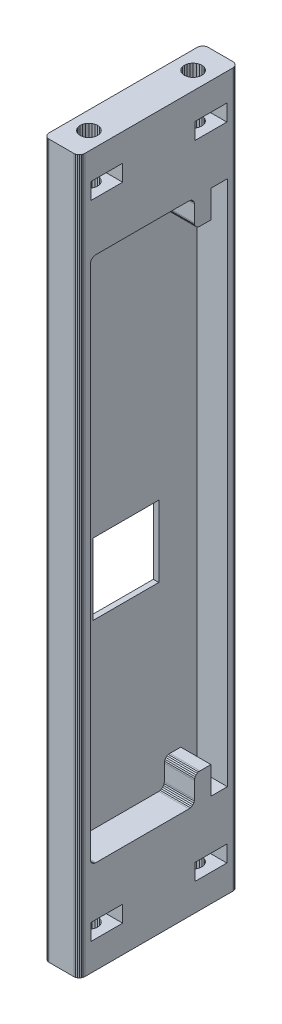
from build123d import *

# Parameters (mm, degrees)
BOSS_EXTRUDE1_DEPTH = 129.999995232
SKETCH2_W           = 5.799999461
SKETCH2_H           = 3.000000492
CUT_EXTRUDE1_DEPTH  = 133.356521456
CUT_EXTRUDE2_REACH  = 134.237
SKETCH4_W           = 5.800000392
SKETCH4_H           = 2.999998629
CUT_EXTRUDE3_DEPTH  = 133.356521456
SKETCH5_W           = 5.800000392
SKETCH5_H           = 3.000000492
CUT_EXTRUDE4_DEPTH  = 133.356521456
SKETCH6_W           = 5.799999461
SKETCH6_H           = 2.999998629
CUT_EXTRUDE5_DEPTH  = 133.356521456
CUT_EXTRUDE6_REACH  = 134.237
CUT_EXTRUDE7_REACH  = 134.237
CUT_EXTRUDE8_DEPTH  = 5.49999997
SKETCH10_W          = 12.00000057
SKETCH10_H          = 13.000000268
CUT_EXTRUDE9_DEPTH  = 133.356521456
CUT_EXTRUDE10_REACH = 134.237
CUT_EXTRUDE11_DEPTH = 6.999999285
CUT_EXTRUDE12_DEPTH = 6.999999285
CUT_EXTRUDE13_DEPTH = 6.999999285
CUT_EXTRUDE14_DEPTH = 6.999999285


with BuildPart() as part:
    # Sketch1 → Boss-Extrude1 (new body)
    with BuildSketch(Plane(origin=(0, 129.999995232, 0), x_dir=(1, 0, 0), z_dir=(0, 1, 0))):
        Polygon((3.215926001, -23.258820176), (3.250000067, -23.000000045), (3.250000067, 4.00000019), (3.215926001, 4.258818924), (3.116025357, 4.499999806), (2.957106801, 4.707106389), (2.749999985, 4.866025411), (2.508819103, 4.965925589), (2.249999903, 4.999999888), (-2.249999903, 4.999999888), (-2.508819103, 4.965925589), (-2.749999985, 4.866025411), (-2.957106801, 4.707106389), (-3.116025357, 4.499999806), (-3.215926001, 4.258818924), (-3.250000067, 4.00000019), (-3.250000067, -23.000000045), (-3.215926001, -23.258820176), (-3.116025357, -23.499999195), (-2.957106801, -23.707106709), (-2.749999985, -23.866025731), (-2.508819103, -23.965924978), (-2.249999903, -24.000000209), (2.249999903, -24.000000209), (2.508819103, -23.965924978), (2.749999985, -23.866025731), (2.957106801, -23.707106709), (3.116025357, -23.499999195), align=None)
    extrude(amount=-BOSS_EXTRUDE1_DEPTH)

    # Sketch2 → Cut-Extrude1 (cut, through all)
    with BuildSketch(Plane.ZY.offset(3.250000067)):
        with Locations((19.00000032, 6.500000134)):
            Rectangle(SKETCH2_W, SKETCH2_H)
    extrude(amount=-CUT_EXTRUDE1_DEPTH, mode=Mode.SUBTRACT)

    # Sketch3 → Cut-Extrude2 (cut, up to next)
    with BuildSketch(Plane.XZ, mode=Mode.PRIVATE) as cut_extrude2_sk1:
        Polygon((1.545481267, 18.585890532), (1.600000076, 18.999999389), (1.545481267, 19.414110109), (1.385640586, 19.799999893), (1.131370896, 20.131370053), (0.800000038, 20.385641605), (0.414110487, 20.545480773), (0, 20.600000396), (-0.414110487, 20.545480773), (-0.800000038, 20.385641605), (-1.131370896, 20.131370053), (-1.385640586, 19.799999893), (-1.545481267, 19.414110109), (-1.600000076, 18.999999389), (-1.545481267, 18.585890532), (-1.385640586, 18.200000748), (-1.131370896, 17.868628725), (-0.800000038, 17.614359036), (-0.414110487, 17.454519868), (0, 17.400000244), (0.414110487, 17.454519868), (0.800000038, 17.614359036), (1.131370896, 17.868628725), (1.385640586, 18.200000748), align=None)
    cut_extrude2_tool1 = extrude(cut_extrude2_sk1.sketch, amount=-CUT_EXTRUDE2_REACH, mode=Mode.PRIVATE) & part.part
    add(cut_extrude2_tool1.solids().sort_by_distance((0, 0, 19))[0], mode=Mode.SUBTRACT)

    # Sketch4 → Cut-Extrude3 (cut, through all)
    with BuildSketch(Plane.ZY.offset(3.250000067)):
        with Locations((0, 123.500000686)):
            Rectangle(SKETCH4_W, SKETCH4_H)
    extrude(amount=-CUT_EXTRUDE3_DEPTH, mode=Mode.SUBTRACT)

    # Sketch5 → Cut-Extrude4 (cut, through all)
    with BuildSketch(Plane.ZY.offset(3.250000067)):
        with Locations((0, 6.500000134)):
            Rectangle(SKETCH5_W, SKETCH5_H)
    extrude(amount=-CUT_EXTRUDE4_DEPTH, mode=Mode.SUBTRACT)

    # Sketch6 → Cut-Extrude5 (cut, through all)
    with BuildSketch(Plane.ZY.offset(3.250000067)):
        with Locations((19.00000032, 123.500000686)):
            Rectangle(SKETCH6_W, SKETCH6_H)
    extrude(amount=-CUT_EXTRUDE5_DEPTH, mode=Mode.SUBTRACT)

    # Sketch7 → Cut-Extrude6 (cut, up to next)
    with BuildSketch(Plane(origin=(0, 129.999995232, 0), x_dir=(-1, 0, 0), z_dir=(0, 1, 0)), mode=Mode.PRIVATE) as cut_extrude6_sk1:
        Polygon((-1.385640586, 0.800000038), (-1.545481267, 0.414110487), (-1.600000076, 0), (-1.545481267, -0.414110487), (-1.385640586, -0.800000038), (-1.131370896, -1.131370896), (-0.800000038, -1.385640586), (-0.414110487, -1.545481267), (0, -1.600000076), (0.414110487, -1.545481267), (0.800000038, -1.385640586), (1.131370896, -1.131370896), (1.385640586, -0.800000038), (1.545481267, -0.414110487), (1.600000076, 0), (1.545481267, 0.414110487), (1.385640586, 0.800000038), (1.131370896, 1.131370896), (0.800000038, 1.385640586), (0.414110487, 1.545481267), (0, 1.600000076), (-0.414110487, 1.545481267), (-0.800000038, 1.385640586), (-1.131370896, 1.131370896), align=None)
    cut_extrude6_tool1 = extrude(cut_extrude6_sk1.sketch, amount=-CUT_EXTRUDE6_REACH, mode=Mode.PRIVATE) & part.part
    add(cut_extrude6_tool1.solids().sort_by_distance((0, 129.999995, 0))[0], mode=Mode.SUBTRACT)

    # Sketch8 → Cut-Extrude7 (cut, up to next)
    with BuildSketch(Plane(origin=(0, 129.999995232, 0), x_dir=(-1, 0, 0), z_dir=(0, 1, 0)), mode=Mode.PRIVATE) as cut_extrude7_sk1:
        Polygon((-1.600000076, 18.999999389), (-1.545481267, 18.585890532), (-1.385640586, 18.200000748), (-1.131370896, 17.868628725), (-0.800000038, 17.614359036), (-0.414110487, 17.454519868), (0, 17.400000244), (0.414110487, 17.454519868), (0.800000038, 17.614359036), (1.131370896, 17.868628725), (1.385640586, 18.200000748), (1.545481267, 18.585890532), (1.600000076, 18.999999389), (1.545481267, 19.414110109), (1.385640586, 19.799999893), (1.131370896, 20.131370053), (0.800000038, 20.385641605), (0.414110487, 20.545480773), (0, 20.600000396), (-0.414110487, 20.545480773), (-0.800000038, 20.385641605), (-1.131370896, 20.131370053), (-1.385640586, 19.799999893), (-1.545481267, 19.414110109), align=None)
    cut_extrude7_tool1 = extrude(cut_extrude7_sk1.sketch, amount=-CUT_EXTRUDE7_REACH, mode=Mode.PRIVATE) & part.part
    add(cut_extrude7_tool1.solids().sort_by_distance((0, 129.999995, 19))[0], mode=Mode.SUBTRACT)

    # Sketch9 → Cut-Extrude8 (cut)
    with BuildSketch(Plane(origin=(3.250000067, 0, 0), x_dir=(0, 0, -1), z_dir=(1, 0, 0))):
        Polygon((-2.499999944, 108.133971691), (-2.70710676, 108.292892575), (-2.866025548, 108.499996364), (-2.96592596, 108.741179109), (-3.000000026, 108.999997377), (-3.000000026, 112.000003457), (-3.034074092, 112.258821726), (-3.133974504, 112.49999702), (-3.29289306, 112.707108259), (-3.500000108, 112.866029143), (-3.74118099, 112.965926528), (-4.00000019, 112.999998033), (-20.999999717, 112.999998033), (-21.258819848, 112.965926528), (-21.50000073, 112.866029143), (-21.707108244, 112.707108259), (-21.866025403, 112.49999702), (-21.96592465, 112.258821726), (-21.999999881, 112.000003457), (-21.999999881, 17.999999225), (-21.96592465, 17.741180956), (-21.866025403, 17.500000075), (-21.707108244, 17.29289256), (-21.50000073, 17.133973539), (-21.258819848, 17.034074292), (-20.999999717, 17.000000924), (-4.00000019, 17.000000924), (-3.74118099, 17.034074292), (-3.500000108, 17.133973539), (-3.29289306, 17.29289256), (-3.133974504, 17.500000075), (-3.034074092, 17.741180956), (-3.000000026, 17.999999225), (-3.000000026, 20.999999717), (-2.96592596, 21.258819848), (-2.866025548, 21.50000073), (-2.70710676, 21.707108244), (-2.499999944, 21.866025403), (-2.258819062, 21.96592465), (-2.000000095, 21.999999881), (0, 21.999999881), (0, 17.000000924), (3.000000026, 17.000000924), (3.000000026, 112.999998033), (0, 112.999998033), (0, 108.000002801), (-2.000000095, 108.000002801), (-2.258819062, 108.034074306), align=None)
    extrude(amount=-CUT_EXTRUDE8_DEPTH, mode=Mode.SUBTRACT)

    # Sketch10 → Cut-Extrude9 (cut, through all)
    with BuildSketch(Plane.ZY.offset(3.250000067)):
        with Locations((10.000000475, 56.500000879)):
            Rectangle(SKETCH10_W, SKETCH10_H)
    extrude(amount=-CUT_EXTRUDE9_DEPTH, mode=Mode.SUBTRACT)

    # Sketch11 → Cut-Extrude10 (cut, up to next)
    with BuildSketch(Plane.XZ, mode=Mode.PRIVATE) as cut_extrude10_sk1:
        Polygon((0.800000038, 1.385640586), (0.414110487, 1.545481267), (0, 1.600000076), (-0.414110487, 1.545481267), (-0.800000038, 1.385640586), (-1.131370896, 1.131370896), (-1.385640586, 0.800000038), (-1.545481267, 0.414110487), (-1.600000076, 0), (-1.545481267, -0.414110487), (-1.385640586, -0.800000038), (-1.131370896, -1.131370896), (-0.800000038, -1.385640586), (-0.414110487, -1.545481267), (0, -1.600000076), (0.414110487, -1.545481267), (0.800000038, -1.385640586), (1.131370896, -1.131370896), (1.385640586, -0.800000038), (1.545481267, -0.414110487), (1.600000076, 0), (1.545481267, 0.414110487), (1.385640586, 0.800000038), (1.131370896, 1.131370896), align=None)
    cut_extrude10_tool1 = extrude(cut_extrude10_sk1.sketch, amount=-CUT_EXTRUDE10_REACH, mode=Mode.PRIVATE) & part.part
    add(cut_extrude10_tool1.solids().sort_by_distance((0, 0, 0))[0], mode=Mode.SUBTRACT)

    # Sketch12 → Cut-Extrude11 (cut)
    with BuildSketch(Plane(origin=(0, 122.000001371, 0), x_dir=(-1, 0, 0), z_dir=(0, 1, 0))):
        Polygon((1.545481267, -0.414110487), (1.600000076, 0), (1.545481267, 0.414110487), (1.385640586, 0.800000038), (1.131370896, 1.131370896), (0.800000038, 1.385640586), (0.414110487, 1.545481267), (0, 1.600000076), (-0.414110487, 1.545481267), (-0.800000038, 1.385640586), (-1.131370896, 1.131370896), (-1.385640586, 0.800000038), (-1.545481267, 0.414110487), (-1.600000076, 0), (-1.545481267, -0.414110487), (-1.385640586, -0.800000038), (-1.131370896, -1.131370896), (-0.800000038, -1.385640586), (-0.414110487, -1.545481267), (0, -1.600000076), (0.414110487, -1.545481267), (0.800000038, -1.385640586), (1.131370896, -1.131370896), (1.385640586, -0.800000038), align=None)
    extrude(amount=-CUT_EXTRUDE11_DEPTH, mode=Mode.SUBTRACT)

    # Sketch13 → Cut-Extrude12 (cut)
    with BuildSketch(Plane(origin=(0, 122.000001371, 0), x_dir=(-1, 0, 0), z_dir=(0, 1, 0))):
        Polygon((1.545481267, 18.585890532), (1.600000076, 18.999999389), (1.545481267, 19.414110109), (1.385640586, 19.799999893), (1.131370896, 20.131370053), (0.800000038, 20.385641605), (0.414110487, 20.545480773), (0, 20.600000396), (-0.414110487, 20.545480773), (-0.800000038, 20.385641605), (-1.131370896, 20.131370053), (-1.385640586, 19.799999893), (-1.545481267, 19.414110109), (-1.600000076, 18.999999389), (-1.545481267, 18.585890532), (-1.385640586, 18.200000748), (-1.131370896, 17.868628725), (-0.800000038, 17.614359036), (-0.414110487, 17.454519868), (0, 17.400000244), (0.414110487, 17.454519868), (0.800000038, 17.614359036), (1.131370896, 17.868628725), (1.385640586, 18.200000748), align=None)
    extrude(amount=-CUT_EXTRUDE12_DEPTH, mode=Mode.SUBTRACT)

    # Sketch14 → Cut-Extrude13 (cut)
    with BuildSketch(Plane.XZ.offset(-8.00000038)):
        Polygon((-0.414110487, -1.545481267), (0, -1.600000076), (0.414110487, -1.545481267), (0.800000038, -1.385640586), (1.131370896, -1.131370896), (1.385640586, -0.800000038), (1.545481267, -0.414110487), (1.600000076, 0), (1.545481267, 0.414110487), (1.385640586, 0.800000038), (1.131370896, 1.131370896), (0.800000038, 1.385640586), (0.414110487, 1.545481267), (0, 1.600000076), (-0.414110487, 1.545481267), (-0.800000038, 1.385640586), (-1.131370896, 1.131370896), (-1.385640586, 0.800000038), (-1.545481267, 0.414110487), (-1.600000076, 0), (-1.545481267, -0.414110487), (-1.385640586, -0.800000038), (-1.131370896, -1.131370896), (-0.800000038, -1.385640586), align=None)
    extrude(amount=-CUT_EXTRUDE13_DEPTH, mode=Mode.SUBTRACT)

    # Sketch15 → Cut-Extrude14 (cut)
    with BuildSketch(Plane.XZ.offset(-8.00000038)):
        Polygon((0, 17.400000244), (0.414110487, 17.454519868), (0.800000038, 17.614359036), (1.131370896, 17.868628725), (1.385640586, 18.200000748), (1.545481267, 18.585890532), (1.600000076, 18.999999389), (1.545481267, 19.414110109), (1.385640586, 19.799999893), (1.131370896, 20.131370053), (0.800000038, 20.385641605), (0.414110487, 20.545480773), (0, 20.600000396), (-0.414110487, 20.545480773), (-0.800000038, 20.385641605), (-1.131370896, 20.131370053), (-1.385640586, 19.799999893), (-1.545481267, 19.414110109), (-1.600000076, 18.999999389), (-1.545481267, 18.585890532), (-1.385640586, 18.200000748), (-1.131370896, 17.868628725), (-0.800000038, 17.614359036), (-0.414110487, 17.454519868), align=None)
    extrude(amount=-CUT_EXTRUDE14_DEPTH, mode=Mode.SUBTRACT)


solid = part.part
